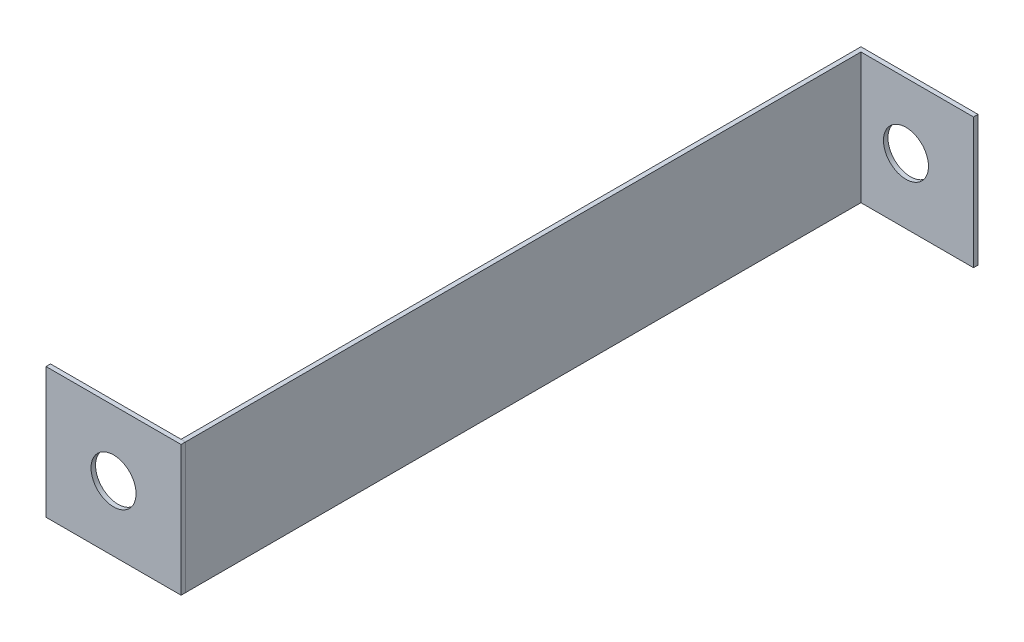
from build123d import *

# Parameters (mm, degrees)
SZKIC1_W                    = 26
SZKIC1_H                    = 29
SZKIC1_R                    = 5
DODANIE_WYCI_GNI_CIE1_DEPTH = 1
SZKIC2_W                    = 1
SZKIC2_H                    = 29
DODANIE_WYCI_GNI_CIE2_DEPTH = 150
SZKIC3_W                    = 29
SZKIC3_H                    = 29
SZKIC3_R                    = 5
SZKIC3_W_2                  = 1
DODANIE_WYCI_GNI_CIE3_DEPTH = 1


with BuildPart() as part:
    # Szkic1 → Dodanie-wyciągnięcie1 (new body)
    with BuildSketch(Plane.XY):
        with Locations((-13, 14.5)):
            Rectangle(SZKIC1_W, SZKIC1_H)
        with Locations((-15, 14.5)):
            Circle(SZKIC1_R, mode=Mode.SUBTRACT)
    extrude(amount=DODANIE_WYCI_GNI_CIE1_DEPTH)

    # Szkic2 → Dodanie-wyciągnięcie2 (add)
    with BuildSketch(Plane.XY.offset(1)):
        with Locations((-25.5, 14.5)):
            Rectangle(SZKIC2_W, SZKIC2_H)
    extrude(amount=DODANIE_WYCI_GNI_CIE2_DEPTH)


with BuildPart() as body_2:
    # Szkic3 → Dodanie-wyciągnięcie3 (new body)
    # profile 1 of 2: a face of its own
    with BuildSketch(Plane.XY.offset(151)):
        with Locations((-40.5, 14.5)):
            Rectangle(SZKIC3_W, SZKIC3_H)
        with Locations((-40, 14.5)):
            Circle(SZKIC3_R, mode=Mode.SUBTRACT)
    # profile 2 of 2: a face of its own
    with BuildSketch(Plane.XY.offset(151)):
        with Locations((-25.5, 14.5)):
            Rectangle(SZKIC3_W_2, SZKIC3_H)
    extrude(amount=DODANIE_WYCI_GNI_CIE3_DEPTH)


solid = Compound([part.part, body_2.part])
